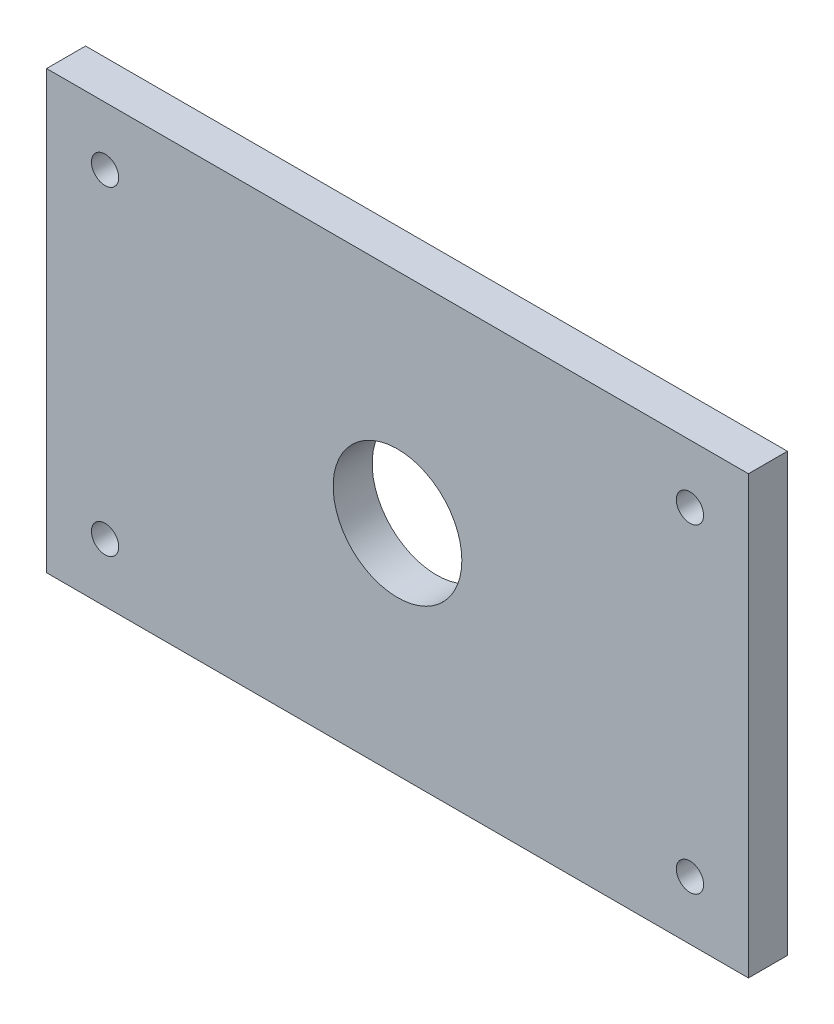
from build123d import *

# Parameters (mm, degrees)
SKETCH_1_W          = 90
SKETCH_1_H          = 56
SKETCH_1_R          = 1.75
EXTRUDE_1_DEPTH     = 5
SKETCH_2_R          = 8.25
CUT_EXTRUDE_1_DEPTH = 5


with BuildPart() as part:
    # ｽｹｯﾁ1 → ﾎﾞｽ - 押し出し1 (new body)
    with BuildSketch(Plane.XY):
        Rectangle(SKETCH_1_W, SKETCH_1_H)
        with Locations((-37.5, 20.5)):
            Circle(SKETCH_1_R, mode=Mode.SUBTRACT)
        with Locations((37.5, 20.5)):
            Circle(SKETCH_1_R, mode=Mode.SUBTRACT)
        with Locations((37.5, -20.5)):
            Circle(SKETCH_1_R, mode=Mode.SUBTRACT)
        with Locations((-37.5, -20.5)):
            Circle(SKETCH_1_R, mode=Mode.SUBTRACT)
    extrude(amount=EXTRUDE_1_DEPTH)

    # ｽｹｯﾁ2 → ｶｯﾄ - 押し出し1 (cut)
    with BuildSketch(Plane.XY.offset(5)):
        Circle(SKETCH_2_R)
    extrude(amount=-CUT_EXTRUDE_1_DEPTH, mode=Mode.SUBTRACT)


solid = part.part
